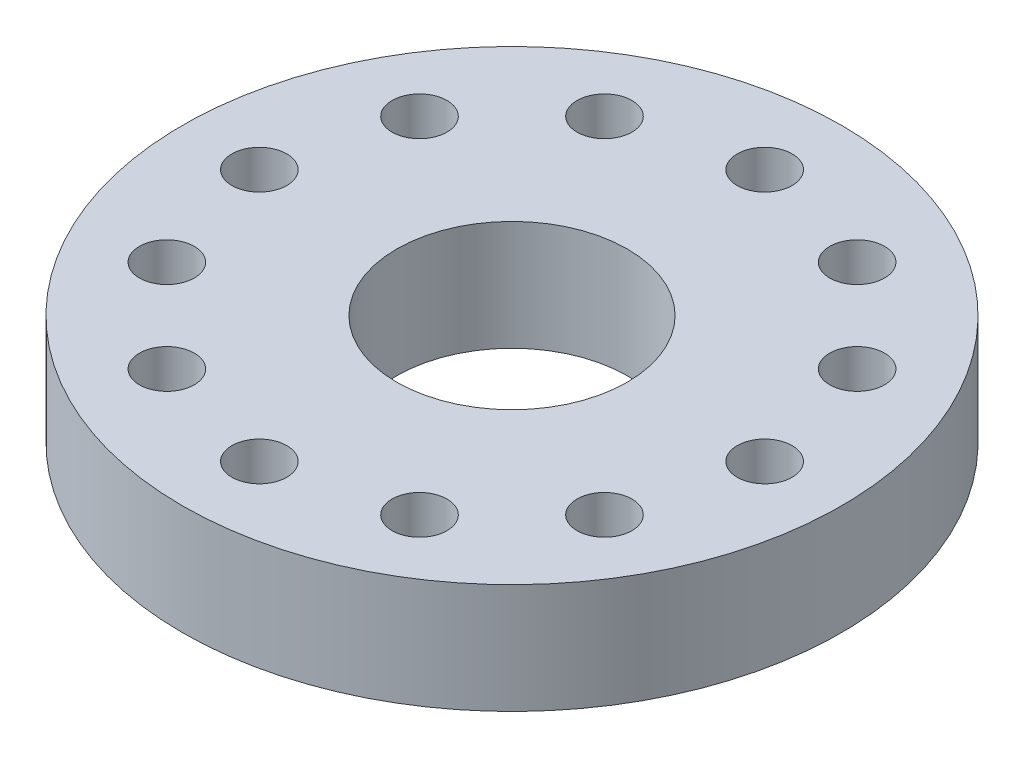
from build123d import *

# Parameters (mm, degrees)
SKETCH1_R           = 30
SKETCH1_R_2         = 2.5
SKETCH1_R_3         = 10.5
BOSS_EXTRUDE1_DEPTH = 10


with BuildPart() as part:
    # Sketch1 → Boss-Extrude1 (new body)
    with BuildSketch(Plane(origin=(0, 0, 0), x_dir=(1, 0, 0), z_dir=(0, 1, 0))):
        with Locations(Location((0, 0, 0), (0, 0, 270))):
            Circle(SKETCH1_R)
        with Locations(Location((0, 23, 0), (0, 0, 270))):
            Circle(SKETCH1_R_2, mode=Mode.SUBTRACT)
        with Locations(Location((11.5, 19.918584287, 0), (0, 0, 270))):
            Circle(SKETCH1_R_2, mode=Mode.SUBTRACT)
        with Locations(Location((19.918584287, 11.5, 0), (0, 0, 270))):
            Circle(SKETCH1_R_2, mode=Mode.SUBTRACT)
        with Locations(Location((23, 0, 0), (0, 0, 270))):
            Circle(SKETCH1_R_2, mode=Mode.SUBTRACT)
        with Locations(Location((19.918584287, -11.5, 0), (0, 0, 270))):
            Circle(SKETCH1_R_2, mode=Mode.SUBTRACT)
        with Locations(Location((11.5, -19.918584287, 0), (0, 0, 270))):
            Circle(SKETCH1_R_2, mode=Mode.SUBTRACT)
        with Locations(Location((0, 0, 0), (0, 0, 270))):
            Circle(SKETCH1_R_3, mode=Mode.SUBTRACT)
        with Locations(Location((0, -23, 0), (0, 0, 270))):
            Circle(SKETCH1_R_2, mode=Mode.SUBTRACT)
        with Locations(Location((-11.5, -19.918584287, 0), (0, 0, 270))):
            Circle(SKETCH1_R_2, mode=Mode.SUBTRACT)
        with Locations(Location((-19.918584287, -11.5, 0), (0, 0, 270))):
            Circle(SKETCH1_R_2, mode=Mode.SUBTRACT)
        with Locations(Location((-23, 0, 0), (0, 0, 270))):
            Circle(SKETCH1_R_2, mode=Mode.SUBTRACT)
        with Locations(Location((-19.918584287, 11.5, 0), (0, 0, 270))):
            Circle(SKETCH1_R_2, mode=Mode.SUBTRACT)
        with Locations(Location((-11.5, 19.918584287, 0), (0, 0, 270))):
            Circle(SKETCH1_R_2, mode=Mode.SUBTRACT)
    extrude(amount=BOSS_EXTRUDE1_DEPTH)


solid = part.part
